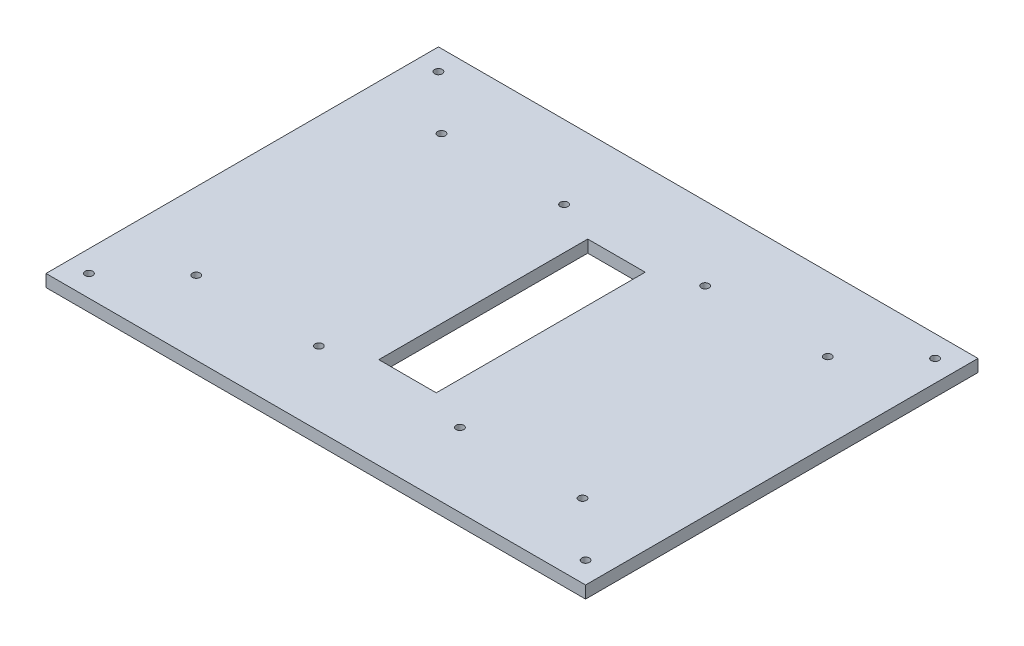
from build123d import *

# Parameters (mm, degrees)
SKETCH_1_W          = 176
SKETCH_1_H          = 128
EXTRUDE_1_DEPTH     = 4
SKETCH_3_W          = 18.73666899
SKETCH_3_H          = 68.153866922
CUT_EXTRUDE_2_DEPTH = 4
HOLE_WIZARD_M3_1_D  = 2.5


with BuildPart() as part:
    # 草图1 → 凸台-拉伸1 (new body)
    with BuildSketch(Plane(origin=(0, 0, 0), x_dir=(1, 0, 0), z_dir=(0, 1, 0))):
        with Locations((88, 64)):
            Rectangle(SKETCH_1_W, SKETCH_1_H)
    extrude(amount=EXTRUDE_1_DEPTH)

    # 草图3 → 切除-拉伸2 (cut)
    with BuildSketch(Plane(origin=(0, 4, 0), x_dir=(1, 0, 0), z_dir=(0, 1, 0))):
        with Locations((88, 64)):
            Rectangle(SKETCH_3_W, SKETCH_3_H)
    extrude(amount=-CUT_EXTRUDE_2_DEPTH, mode=Mode.SUBTRACT)

    # M3 螺纹孔1 (through all)
    with Locations(Plane(origin=(0, 4, 0), x_dir=(1, 0, 0), z_dir=(0, 1, 0))):
        with Locations((7, 121), (25, 104), (65, 104), (65, 24), (25, 24), (7, 7), (169, 7), (111, 24), (151, 24), (151, 104), (111, 104), (169, 121)):
            Hole(HOLE_WIZARD_M3_1_D / 2)


solid = part.part
